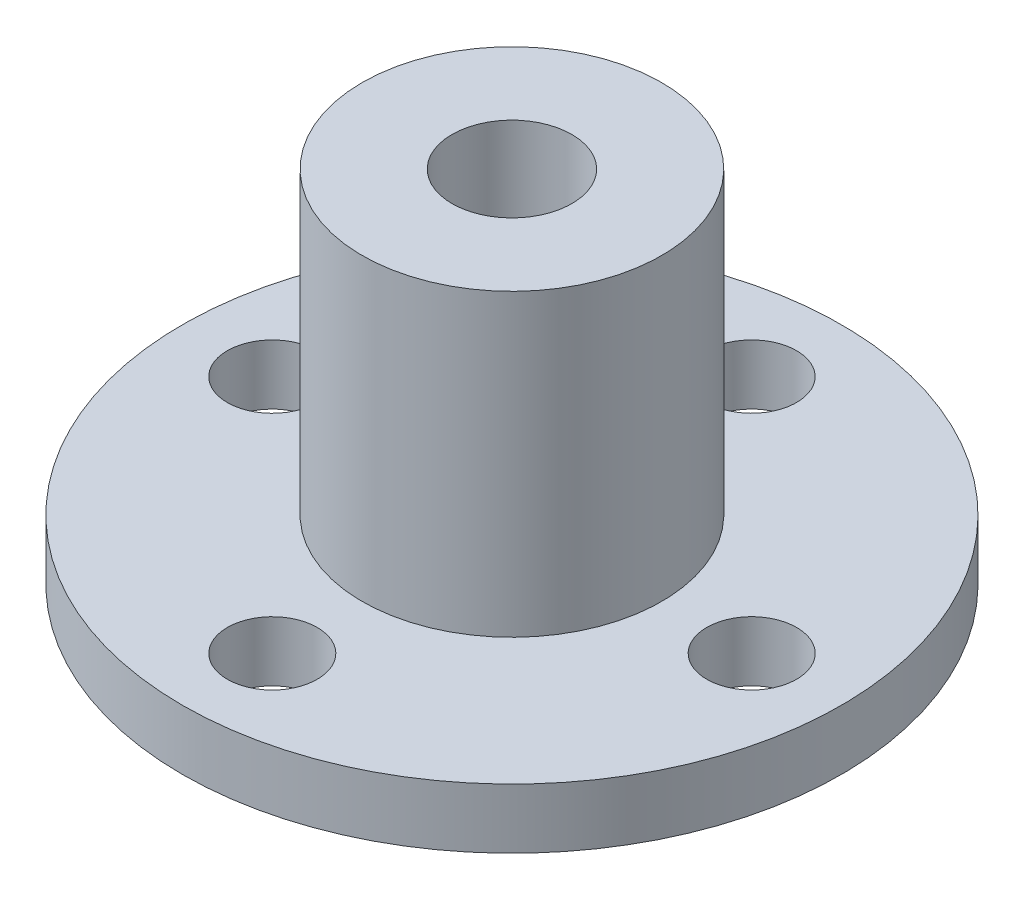
from build123d import *

# Parameters (mm, degrees)
SKETCH_1_R          = 11
EXTRUDE_1_DEPTH     = 2
SKETCH_2_R          = 5
EXTRUDE_2_DEPTH     = 10
SKETCH_3_R          = 1.5
CUT_EXTRUDE_1_DEPTH = 10
SKETCH_5_R          = 2
CUT_EXTRUDE_2_DEPTH = 20.646882704


with BuildPart() as part:
    # 草图1 → 凸台-拉伸1 (new body)
    with BuildSketch(Plane(origin=(0, 0, 0), x_dir=(0, 0, -1), z_dir=(0, 1, 0))):
        with Locations(Location((0, 0, 0), (0, 0, 180))):
            Circle(SKETCH_1_R)
    extrude(amount=EXTRUDE_1_DEPTH)

    # 草图2 → 凸台-拉伸2 (add)
    with BuildSketch(Plane(origin=(0, 2, 0), x_dir=(0, 0, -1), z_dir=(0, 1, 0))):
        with Locations(Location((0, 0, 0), (0, 0, 90))):
            Circle(SKETCH_2_R)
    extrude(amount=EXTRUDE_2_DEPTH)

    # 草图3 → 切除-拉伸1 (cut)
    with BuildSketch(Plane(origin=(0, 2, 0), x_dir=(0, 0, -1), z_dir=(0, 1, 0))):
        with Locations(Location((0, 8, 0), (0, 0, 90))):
            Circle(SKETCH_3_R)
        with Locations(Location((8.001, 0.001, 0), (0, 0, 90))):
            Circle(SKETCH_3_R)
        with Locations(Location((0.002, -8, 0), (0, 0, 90))):
            Circle(SKETCH_3_R)
        with Locations(Location((-7.999, -0.001, 0), (0, 0, 90))):
            Circle(SKETCH_3_R)
    extrude(amount=-CUT_EXTRUDE_1_DEPTH, mode=Mode.SUBTRACT)

    # 草图5 → 切除-拉伸2 (cut, through all)
    with BuildSketch(Plane(origin=(0, 12, 0), x_dir=(1, 0, 0), z_dir=(0, 1, 0))):
        with Locations(Location((0, 0, 0), (0, 0, 180))):
            Circle(SKETCH_5_R)
    extrude(amount=-CUT_EXTRUDE_2_DEPTH, mode=Mode.SUBTRACT)


solid = part.part
